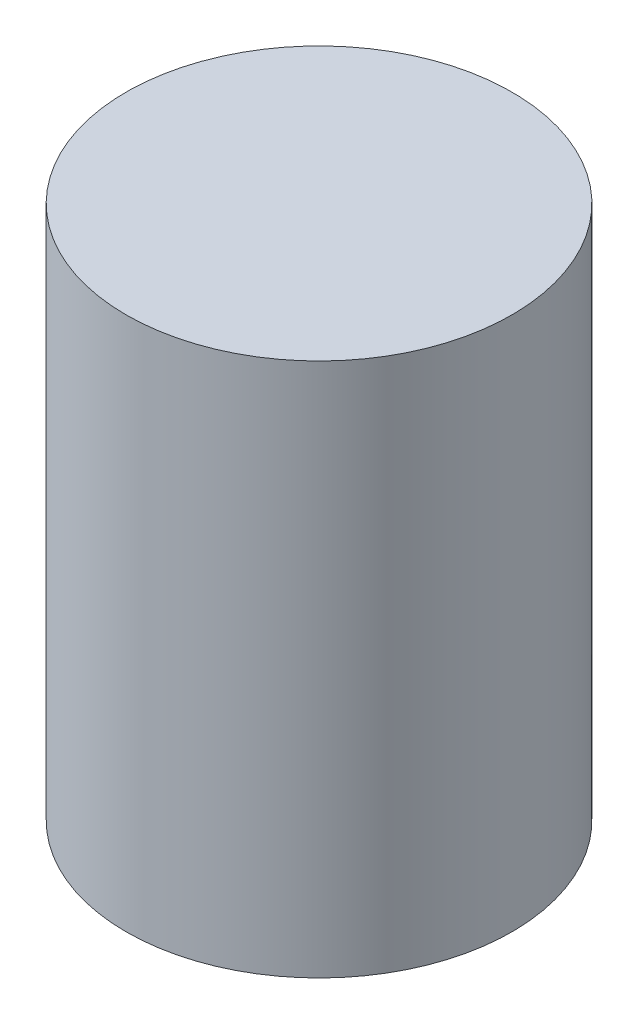
from build123d import *

# Parameters (mm, degrees)
SKETCH1_R           = 6.5
BOSS_EXTRUDE1_DEPTH = 18
SKETCH2_R           = 5
CUT_EXTRUDE1_DEPTH  = 4
CUT_EXTRUDE2_DEPTH  = 12
CHAMFER1_SIZE       = 1
CHAMFER1_SIZE2      = 0.577350269


with BuildPart() as part:
    # Sketch1 → Boss-Extrude1 (new body)
    with BuildSketch(Plane(origin=(0, 0, 0), x_dir=(1, 0, 0), z_dir=(0, 1, 0))):
        with Locations(Location((0, 0, 0), (0, 0, 270))):
            Circle(SKETCH1_R)
    extrude(amount=BOSS_EXTRUDE1_DEPTH)

    # Sketch2 → Cut-Extrude1 (cut)
    with BuildSketch(Plane.XZ):
        with Locations(Location((0, 0, 0), (0, 0, 270))):
            Circle(SKETCH2_R)
    extrude(amount=-CUT_EXTRUDE1_DEPTH, mode=Mode.SUBTRACT)

    # Sketch3 → Cut-Extrude2 (cut)
    with BuildSketch(Plane.XZ.offset(-4)):
        with BuildLine():
            Line((-1.732055507, -2.57098886), (3.04828024, -0.563903873))
            ThreePointArc((3.04828024, -0.563903873), (-1.200087257, 2.858284551), (-1.732055507, -2.57098886))
        make_face()
    extrude(amount=-CUT_EXTRUDE2_DEPTH, mode=Mode.SUBTRACT)

    # Chamfer1
    chamfer1_edges = [part.edges().sort_by_distance(p)[0] for p in [
        (0, 0, 5),
    ]]
    chamfer1_side = [part.faces().sort_by_distance(p)[0] for p in [
        (0, 2, 5),
    ]]
    chamfer(chamfer1_edges, length=CHAMFER1_SIZE, length2=CHAMFER1_SIZE2, reference=chamfer1_side[0])


solid = part.part
